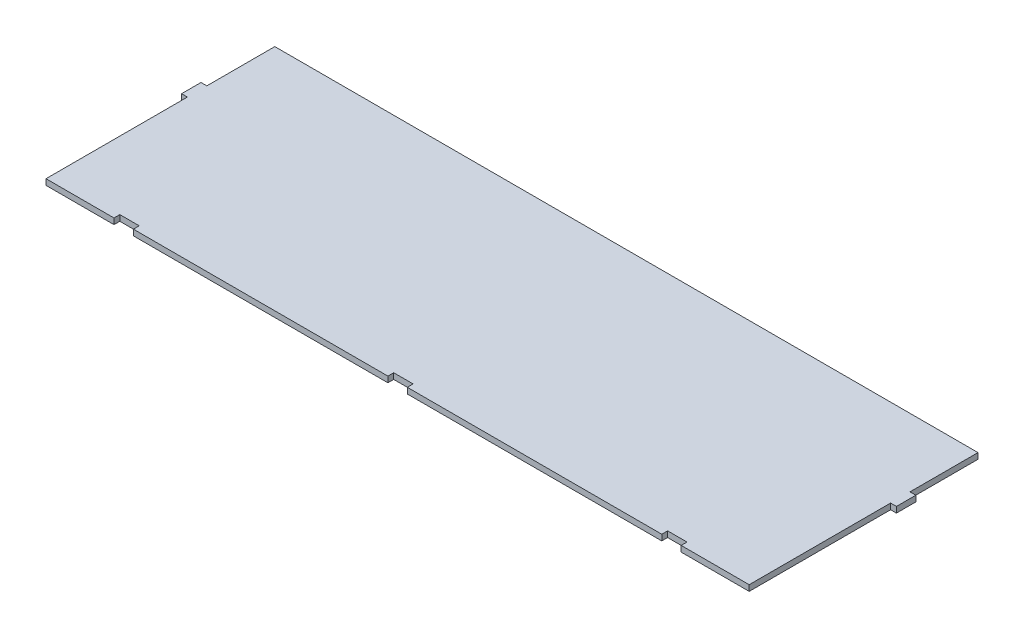
from build123d import *

# Parameters (mm, degrees)
BOSS_EXTRUDE1_DEPTH = 3


with BuildPart() as part:
    # Sketch1 → Boss-Extrude1 (new body)
    with BuildSketch(Plane(origin=(0, 0, 0), x_dir=(1, 0, 0), z_dir=(0, 1, 0))):
        Polygon((-184, 33.695), (-181, 33.695), (-181, 68.695), (181, 68.695), (181, 33.695), (184, 33.695), (184, 23.695), (181, 23.695), (181, -49.095), (146, -49.095), (146, -46.095), (136, -46.095), (136, -49.095), (5, -49.095), (5, -46.095), (-5, -46.095), (-5, -49.095), (-136, -49.095), (-136, -46.095), (-146, -46.095), (-146, -49.095), (-181, -49.095), (-181, 23.695), (-184, 23.695), align=None)
    extrude(amount=BOSS_EXTRUDE1_DEPTH)


solid = part.part
